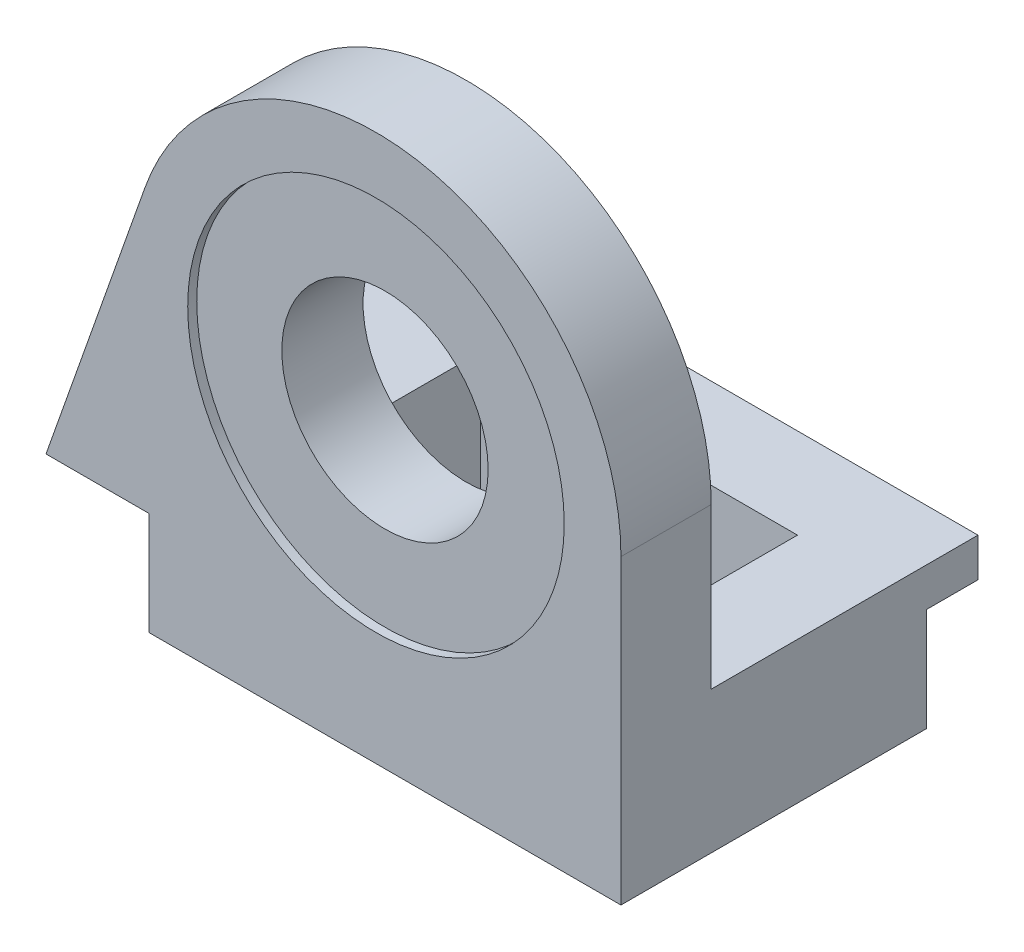
from build123d import *

# Parameters (mm, degrees)
BOSS_EXTRUDE1_DEPTH = 35
SKETCH2_W           = 35
SKETCH2_H           = 55
BOSS_EXTRUDE2_DEPTH = 83.45
BOSS_EXTRUDE3_DEPTH = 20
SKETCH4_W           = 122.95
SKETCH4_H           = 15
BOSS_EXTRUDE4_DEPTH = 55
SKETCH5_R           = 73
CUT_EXTRUDE1_DEPTH  = 3.5
CUT_EXTRUDE2_REACH  = 221.708
SKETCH6_R           = 40


with BuildPart() as part:
    # Sketch1 → Boss-Extrude1 (new body)
    with BuildSketch(Plane.XY):
        with BuildLine():
            Line((-95, -77), (-87.95, -77))
            Line((-87.95, -77), (-87.95, -95))
            Line((-87.95, -95), (-87.95, -117))
            Line((-87.95, -117), (95, -117))
            Line((95, -117), (95, -95))
            Line((95, -95), (95, 0))
            ThreePointArc((95, 0), (16.050772972, 93.63424954), (-89.576267094, 31.640043828))
            Line((-89.576267094, 31.640043828), (-127.95, -77))
            Line((-127.95, -77), (-95, -77))
        make_face()
    extrude(amount=BOSS_EXTRUDE1_DEPTH)

    # Sketch2 → Boss-Extrude2 (add)
    with BuildSketch(Plane(origin=(0, 0, 0), x_dir=(-1, 0, 0), z_dir=(0, 0, -1))):
        Polygon((127.95, -77), (122.651714273, -62), (88.977103652, -62), (62.95, -62), (62.95, -117), (87.95, -117), (87.95, -77), align=None)
        with Locations((-77.5, -89.5)):
            Rectangle(SKETCH2_W, SKETCH2_H)
    extrude(amount=BOSS_EXTRUDE2_DEPTH)

    # Sketch3 → Boss-Extrude3 (add)
    with BuildSketch(Plane(origin=(0, 0, -83.45), x_dir=(-1, 0, 0), z_dir=(0, 0, -1))):
        Polygon((127.95, -77), (-95, -77), (-95, -62), (122.651714273, -62), align=None)
    extrude(amount=BOSS_EXTRUDE3_DEPTH)

    # Sketch4 → Boss-Extrude4 (add)
    with BuildSketch(Plane(origin=(0, -62, 0), x_dir=(1, 0, 0), z_dir=(0, 1, 0))):
        with Locations((-1.475, 75.95)):
            Rectangle(SKETCH4_W, SKETCH4_H)
    extrude(amount=-BOSS_EXTRUDE4_DEPTH)

    # Sketch5 → Cut-Extrude1 (cut)
    with BuildSketch(Plane.XY.offset(35)):
        Circle(SKETCH5_R)
    extrude(amount=-CUT_EXTRUDE1_DEPTH, mode=Mode.SUBTRACT)

    # Sketch6 → Cut-Extrude2 (cut, up to next)
    with BuildSketch(Plane.XY.offset(31.5), mode=Mode.PRIVATE) as cut_extrude2_sk1:
        Circle(SKETCH6_R)
    cut_extrude2_tool1 = extrude(cut_extrude2_sk1.sketch, amount=-CUT_EXTRUDE2_REACH, mode=Mode.PRIVATE) & part.part
    add(cut_extrude2_tool1.solids().sort_by_distance((0, 0, 31.5))[0], mode=Mode.SUBTRACT)


solid = part.part
